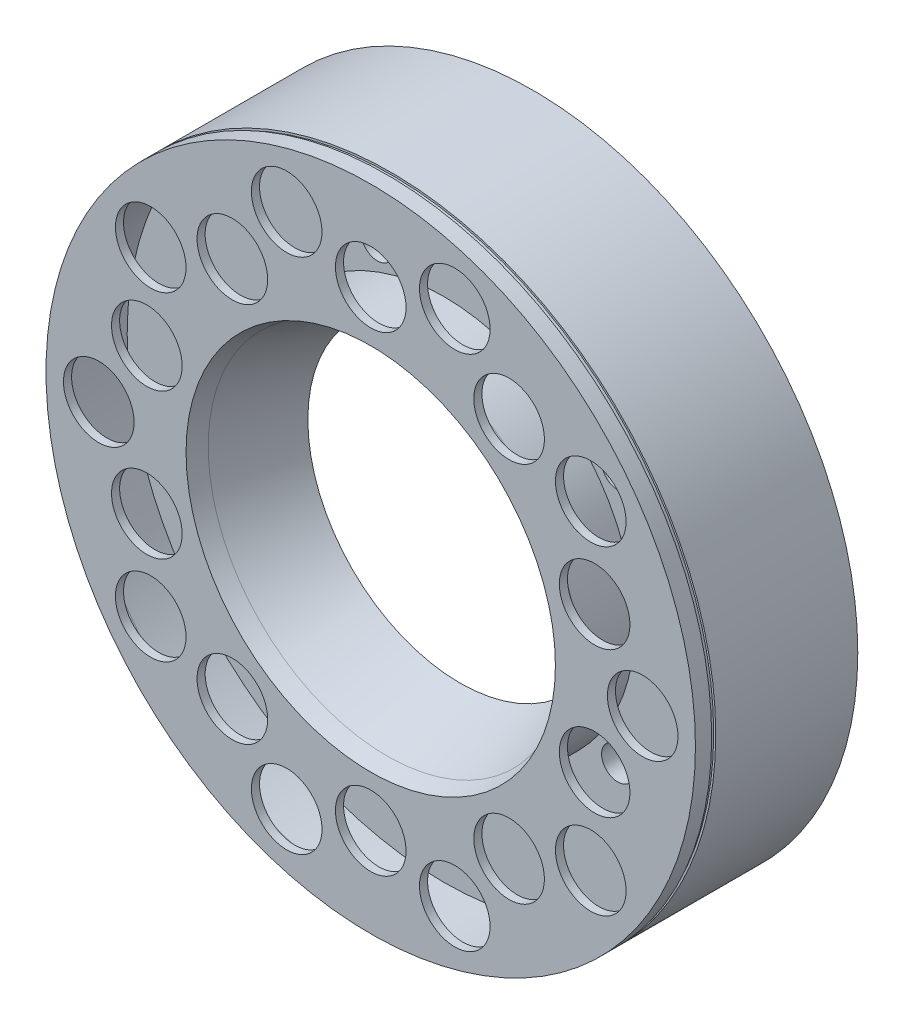
from build123d import *

# Parameters (mm, degrees)
SKETCH1_R           = 101.6
BOSS_EXTRUDE2_DEPTH = 50.8
SKETCH5_R           = 57.785
CUT_EXTRUDE1_DEPTH  = 50.8
CUT_EXTRUDE1_DRAFT  = -20
SKETCH6_R           = 11.049
CUT_EXTRUDE2_DEPTH  = 22.86
SKETCH7_R           = 11.049
CUT_EXTRUDE3_DEPTH  = 22.86
SKETCH8_R           = 99.06
CUT_EXTRUDE4_DEPTH  = 22.86
SKETCH11_R          = 99.06
SKETCH11_R_2        = 59.69
CUT_EXTRUDE6_DEPTH  = 20.32
SKETCH12_R          = 5.08
CUT_EXTRUDE7_DEPTH  = 5.08
SKETCH14_R          = 100.453041608
CUT_EXTRUDE8_DEPTH  = 2.54
SKETCH20_R          = 101.6
SKETCH20_R_2        = 100.965
CUT_EXTRUDE12_DEPTH = 1.27
SKETCH21_R          = 100.965
SKETCH21_R_2        = 100.33
CUT_EXTRUDE13_DEPTH = 1.27
SKETCH22_R          = 58.42
SKETCH22_R_2        = 57.785
CUT_EXTRUDE14_DEPTH = 1.27
SKETCH24_R          = 59.055
SKETCH24_R_2        = 58.42
CUT_EXTRUDE16_DEPTH = 1.27


with BuildPart() as part:
    # Sketch1 → Boss-Extrude2 (new body)
    with BuildSketch(Plane.XY):
        Circle(SKETCH1_R)
    extrude(amount=-BOSS_EXTRUDE2_DEPTH)


with BuildPart() as cut_extrude1_tool:
    # Sketch5 → Cut-Extrude1 (with draft: the straight prism first)
    with BuildSketch(Plane.XY):
        Circle(SKETCH5_R)
    extrude(amount=-CUT_EXTRUDE1_DEPTH)
    # Cut-Extrude1: the draft: its side faces are tilted about the plane it starts from
    cut_extrude1_sides = [cut_extrude1_tool.faces().sort_by_distance(p)[0] for p in [
        (-57.785, 0, -25.4),
    ]]
    draft(cut_extrude1_sides, Plane.XY, CUT_EXTRUDE1_DRAFT)


with BuildPart() as part_1:
    add(part.part)

    # Cut-Extrude1: cut by cut_extrude1_tool
    add(cut_extrude1_tool.part, mode=Mode.SUBTRACT)

    # Sketch6 → Cut-Extrude2 (cut)
    with BuildSketch(Plane.XY):
        with Locations((0, 73.66)):
            Circle(SKETCH6_R)
        with Locations((43.296261684, 59.592191806)):
            Circle(SKETCH6_R)
        with Locations((70.05482299, 22.762191806)):
            Circle(SKETCH6_R)
        with Locations((70.05482299, -22.762191806)):
            Circle(SKETCH6_R)
        with Locations((43.296261684, -59.592191806)):
            Circle(SKETCH6_R)
        with Locations((0, -73.66)):
            Circle(SKETCH6_R)
        with Locations((-43.296261684, -59.592191806)):
            Circle(SKETCH6_R)
        with Locations((-70.05482299, -22.762191806)):
            Circle(SKETCH6_R)
        with Locations((-70.05482299, 22.762191806)):
            Circle(SKETCH6_R)
        with Locations((-43.296261684, 59.592191806)):
            Circle(SKETCH6_R)
    extrude(amount=-CUT_EXTRUDE2_DEPTH, mode=Mode.SUBTRACT)

    # Sketch7 → Cut-Extrude3 (cut)
    with BuildSketch(Plane.XY):
        with Locations((-85.09, 0)):
            Circle(SKETCH7_R)
        with Locations((-68.839256051, 50.014647118)):
            Circle(SKETCH7_R)
        with Locations((-26.294256051, 80.925398972)):
            Circle(SKETCH7_R)
        with Locations((26.294256051, 80.925398972)):
            Circle(SKETCH7_R)
        with Locations((68.839256051, 50.014647118)):
            Circle(SKETCH7_R)
        with Locations((85.09, 0)):
            Circle(SKETCH7_R)
        with Locations((68.839256051, -50.014647118)):
            Circle(SKETCH7_R)
        with Locations((26.294256051, -80.925398972)):
            Circle(SKETCH7_R)
        with Locations((-26.294256051, -80.925398972)):
            Circle(SKETCH7_R)
        with Locations((-68.839256051, -50.014647118)):
            Circle(SKETCH7_R)
    extrude(amount=-CUT_EXTRUDE3_DEPTH, mode=Mode.SUBTRACT)

    # Sketch8 → Cut-Extrude4 (cut)
    with BuildSketch(Plane(origin=(0, 0, -50.8), x_dir=(-1, 0, 0), z_dir=(0, 0, -1))):
        Circle(SKETCH8_R)
    extrude(amount=-CUT_EXTRUDE4_DEPTH, mode=Mode.SUBTRACT)

    # Sketch11 → Cut-Extrude6 (cut)
    with BuildSketch(Plane.XY.offset(-22.86)):
        with Locations(Location((0, 0, 0), (0, 0, 180))):
            Circle(SKETCH11_R)
        Circle(SKETCH11_R_2, mode=Mode.SUBTRACT)
    extrude(amount=CUT_EXTRUDE6_DEPTH, mode=Mode.SUBTRACT)

    # Sketch12 → Cut-Extrude7 (cut)
    with BuildSketch(Plane.XY.offset(-22.86)):
        with Locations((-67.31, 0)):
            Circle(SKETCH12_R)
        with Locations((-20.799933891, 64.015614112)):
            Circle(SKETCH12_R)
        with Locations((54.454933891, 39.563825332)):
            Circle(SKETCH12_R)
        with Locations((54.454933891, -39.563825332)):
            Circle(SKETCH12_R)
        with Locations((-20.799933891, -64.015614112)):
            Circle(SKETCH12_R)
    extrude(amount=-CUT_EXTRUDE7_DEPTH, mode=Mode.SUBTRACT)


with BuildPart() as body_2:
    # Split1: the piece on the far side of the plane
    add(part_1.part)
    split(bisect_by=Plane.XY.offset(-5.08), keep=Keep.BOTTOM)

    # Sketch14 → Cut-Extrude8 (cut)
    with BuildSketch(Plane(origin=(0, 0, -50.8), x_dir=(-1, 0, 0), z_dir=(0, 0, -1))):
        Circle(SKETCH14_R)
    extrude(amount=-CUT_EXTRUDE8_DEPTH, mode=Mode.SUBTRACT)

    # Sketch20 → Cut-Extrude12 (cut)
    with BuildSketch(Plane.XY.offset(-5.08)):
        Circle(SKETCH20_R)
        Circle(SKETCH20_R_2, mode=Mode.SUBTRACT)
    extrude(amount=-CUT_EXTRUDE12_DEPTH, mode=Mode.SUBTRACT)

    # Sketch22 → Cut-Extrude14 (cut)
    with BuildSketch(Plane.XY.offset(-5.08)):
        Circle(SKETCH22_R)
        Circle(SKETCH22_R_2, mode=Mode.SUBTRACT)
    extrude(amount=-CUT_EXTRUDE14_DEPTH, mode=Mode.SUBTRACT)


with BuildPart() as part_2:
    add(part_1.part)

    # Split1
    split(bisect_by=Plane.XY.offset(-5.08), keep=Keep.TOP)

    # Sketch21 → Cut-Extrude13 (cut)
    with BuildSketch(Plane.XY.offset(-5.08)):
        Circle(SKETCH21_R)
        Circle(SKETCH21_R_2, mode=Mode.SUBTRACT)
    extrude(amount=CUT_EXTRUDE13_DEPTH, mode=Mode.SUBTRACT)

    # Sketch24 → Cut-Extrude16 (cut)
    with BuildSketch(Plane.XY.offset(-5.08)):
        Circle(SKETCH24_R)
        Circle(SKETCH24_R_2, mode=Mode.SUBTRACT)
    extrude(amount=CUT_EXTRUDE16_DEPTH, mode=Mode.SUBTRACT)


solid = Compound([body_2.part, part_2.part])
